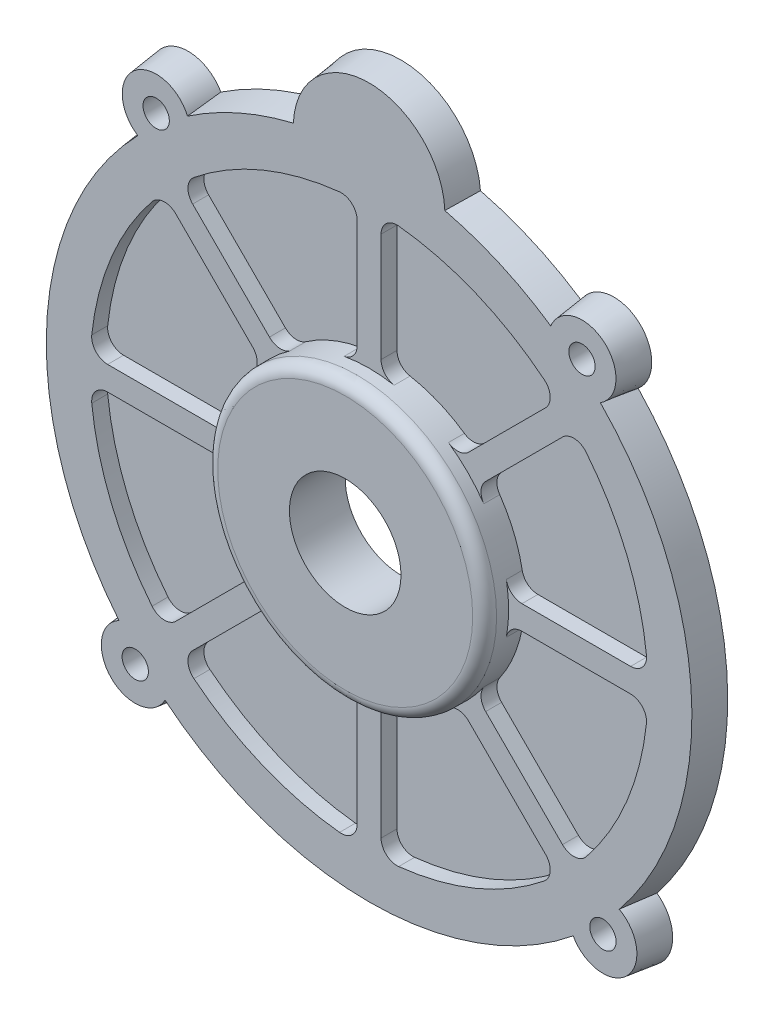
from build123d import *

# Parameters (mm, degrees)
BOSS_EXTRUDE1_START        = -4
BOSS_EXTRUDE1_DEPTH        = 4
BOSS_EXTRUDE1_DRAFT        = 7
CUT_EXTRUDE1_DEPTH         = 2
FILLET1_R                  = 2
CIRPATTERN1_COUNT          = 8
FILLET1_OF_CIRPATTERN1_R   = 2
M4X0_7_TAPPED_HOLE1_D      = 3.3
BOSS_EXTRUDE2_START        = 3
SKETCH9_R                  = 17.5
BOSS_EXTRUDE2_DEPTH        = 3
FILLET2_R                  = 1.5
F_14_0_14_DIAMETER_HOLE1_D = 14


with BuildPart() as part:
    # Sketch2 → Boss-Extrude1 (with draft: the straight prism first)
    with BuildSketch(Plane.XY.offset(BOSS_EXTRUDE1_START)):
        with BuildLine():
            ThreePointArc((-22.599988577, 34.208778352), (-29.7710089, 35.479706812), (-29.76462331, 28.19693599))
            ThreePointArc((-29.76462331, 28.19693599), (-40.960735586, 1.79391757), (-32.115758696, -25.486820975))
            ThreePointArc((-32.115758696, -25.486820975), (-32.70368863, -32.70368863), (-25.486820975, -32.115758696))
            ThreePointArc((-25.486820975, -32.115758696), (0, -41), (25.486820975, -32.115758696))
            ThreePointArc((25.486820975, -32.115758696), (32.70368863, -32.70368863), (32.115758696, -25.486820975))
            ThreePointArc((32.115758696, -25.486820975), (40.960735586, 1.79391757), (29.76462331, 28.19693599))
            ThreePointArc((29.76462331, 28.19693599), (29.7710089, 35.479706812), (22.599988577, 34.208778352))
            ThreePointArc((22.599988577, 34.208778352), (16.520796809, 37.524169182), (9.970370305, 39.769230769))
            ThreePointArc((9.970370305, 39.769230769), (0, 49), (-9.970370305, 39.769230769))
            ThreePointArc((-9.970370305, 39.769230769), (-16.520796809, 37.524169182), (-22.599988577, 34.208778352))
        make_face()
    extrude(amount=BOSS_EXTRUDE1_DEPTH)
    # Boss-Extrude1: the draft: its side faces are tilted about the plane it starts from
    boss_extrude1_sides = [part.faces().sort_by_distance(p)[0] for p in [
        (-16.520796809, 37.524169182, -2),
        (-29.7710089, 35.479706812, -2),
        (-40.960735586, 1.79391757, -2),
        (-32.70368863, -32.70368863, -2),
        (0, -41, -2),
        (32.70368863, -32.70368863, -2),
        (40.960735586, 1.79391757, -2),
        (29.7710089, 35.479706812, -2),
        (16.520796809, 37.524169182, -2),
        (0, 49, -2),
    ]]
    draft(boss_extrude1_sides, Plane.XY.offset(BOSS_EXTRUDE1_START), BOSS_EXTRUDE1_DRAFT)

    # Sketch4 → Cut-Extrude1 (cut)
    with BuildSketch(Plane.XY):
        with BuildLine():
            Line((-13.389488178, -11.268167834), (-25.786658635, -23.665338291))
            ThreePointArc((-25.786658635, -23.665338291), (-32.335783638, -13.393920133), (-34.96784237, -1.5))
            Line((-34.96784237, -1.5), (-17.435595774, -1.5))
            ThreePointArc((-17.435595774, -1.5), (-16.167891819, -6.696960066), (-13.389488178, -11.268167834))
        make_face()
    cut_extrude1 = extrude(amount=-CUT_EXTRUDE1_DEPTH, mode=Mode.SUBTRACT)

    # Fillet1
    fillet1_edges = [part.edges().sort_by_distance(p)[0] for p in [
        (-17.435595774, -1.5, -1),
        (-13.389488178, -11.268167834, -1),
        (-25.786658635, -23.665338291, -1),
        (-34.96784237, -1.5, -1),
    ]]
    fillet(fillet1_edges, radius=FILLET1_R)

    # CirPattern1: Cut-Extrude1 ×8 about axis
    cirpattern1_axis = Axis((0, 0, 0), (0, 0, 1))
    for i in range(1, CIRPATTERN1_COUNT):
        add(cut_extrude1.rotate(cirpattern1_axis, i * 360 / CIRPATTERN1_COUNT), mode=Mode.SUBTRACT)

    # Fillet1 of CirPattern1
    fillet1_of_cirpattern1_edges = [part.edges().sort_by_distance(p)[0] for p in [
        (-11.268167834, -13.389488178, -1),
        (-1.5, -17.435595774, -1),
        (-1.5, -34.96784237, -1),
        (-23.665338291, -25.786658635, -1),
        (1.5, -17.435595774, -1),
        (11.268167834, -13.389488178, -1),
        (23.665338291, -25.786658635, -1),
        (1.5, -34.96784237, -1),
        (13.389488178, -11.268167834, -1),
        (17.435595774, -1.5, -1),
        (34.96784237, -1.5, -1),
        (25.786658635, -23.665338291, -1),
        (17.435595774, 1.5, -1),
        (13.389488178, 11.268167834, -1),
        (25.786658635, 23.665338291, -1),
        (34.96784237, 1.5, -1),
        (11.268167834, 13.389488178, -1),
        (1.5, 17.435595774, -1),
        (1.5, 34.96784237, -1),
        (23.665338291, 25.786658635, -1),
        (-1.5, 17.435595774, -1),
        (-11.268167834, 13.389488178, -1),
        (-23.665338291, 25.786658635, -1),
        (-1.5, 34.96784237, -1),
        (-13.389488178, 11.268167834, -1),
        (-17.435595774, 1.5, -1),
        (-34.96784237, 1.5, -1),
        (-25.786658635, 23.665338291, -1),
    ]]
    fillet(fillet1_of_cirpattern1_edges, radius=FILLET1_OF_CIRPATTERN1_R)

    # M4x0.7 Tapped Hole1 (through all)
    with Locations(Plane(origin=(0, 0, -4), x_dir=(-1, 0, 0), z_dir=(0, 0, -1))):
        with Locations((26.717767754, 31.840995707), (29.344931419, -29.344931419), (-29.344931419, -29.344931419), (-26.717767754, 31.840995707)):
            Hole(M4X0_7_TAPPED_HOLE1_D / 2)

    # Sketch9 → Boss-Extrude2 (add)
    with BuildSketch(Plane.XY.offset(BOSS_EXTRUDE2_START)):
        Circle(SKETCH9_R)
    extrude(amount=-BOSS_EXTRUDE2_DEPTH)

    # Fillet2
    fillet2_edges = [part.edges().sort_by_distance(p)[0] for p in [
        (-17.5, 0, 3),
    ]]
    fillet(fillet2_edges, radius=FILLET2_R)

    # Ø14.0 (14) Diameter Hole1 (through all)
    with Locations(Plane.XY.offset(3)):
        with Locations((0, 0)):
            Hole(F_14_0_14_DIAMETER_HOLE1_D / 2)


solid = part.part
